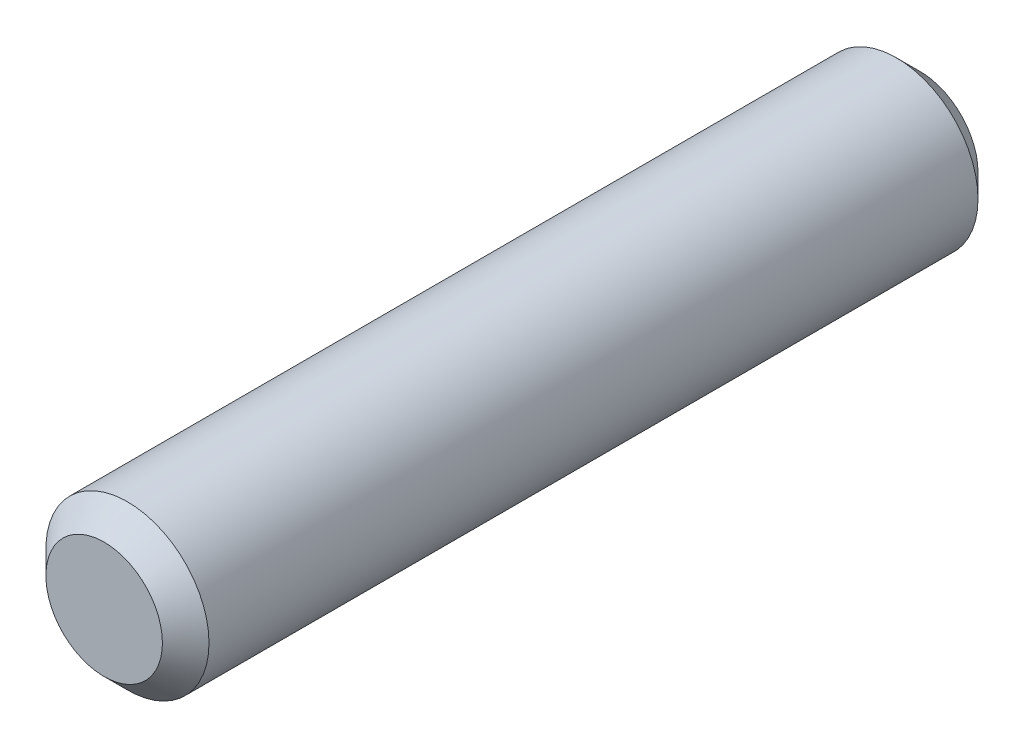
from build123d import *

# Parameters (mm, degrees)
SKETCH1_R           = 7
BOSS_EXTRUDE1_DEPTH = 70
CHAMFER1_SIZE       = 2
CHAMFER2_SIZE       = 2


with BuildPart() as part:
    # Sketch1 → Boss-Extrude1 (new body)
    with BuildSketch(Plane.XY):
        Circle(SKETCH1_R)
    extrude(amount=BOSS_EXTRUDE1_DEPTH)

    # Chamfer1
    chamfer1_edges = [part.edges().sort_by_distance(p)[0] for p in [
        (-7, 0, 70),
    ]]
    chamfer(chamfer1_edges, length=CHAMFER1_SIZE)

    # Chamfer2
    chamfer2_edges = [part.edges().sort_by_distance(p)[0] for p in [
        (-7, 0, 0),
    ]]
    chamfer(chamfer2_edges, length=CHAMFER2_SIZE)


solid = part.part
